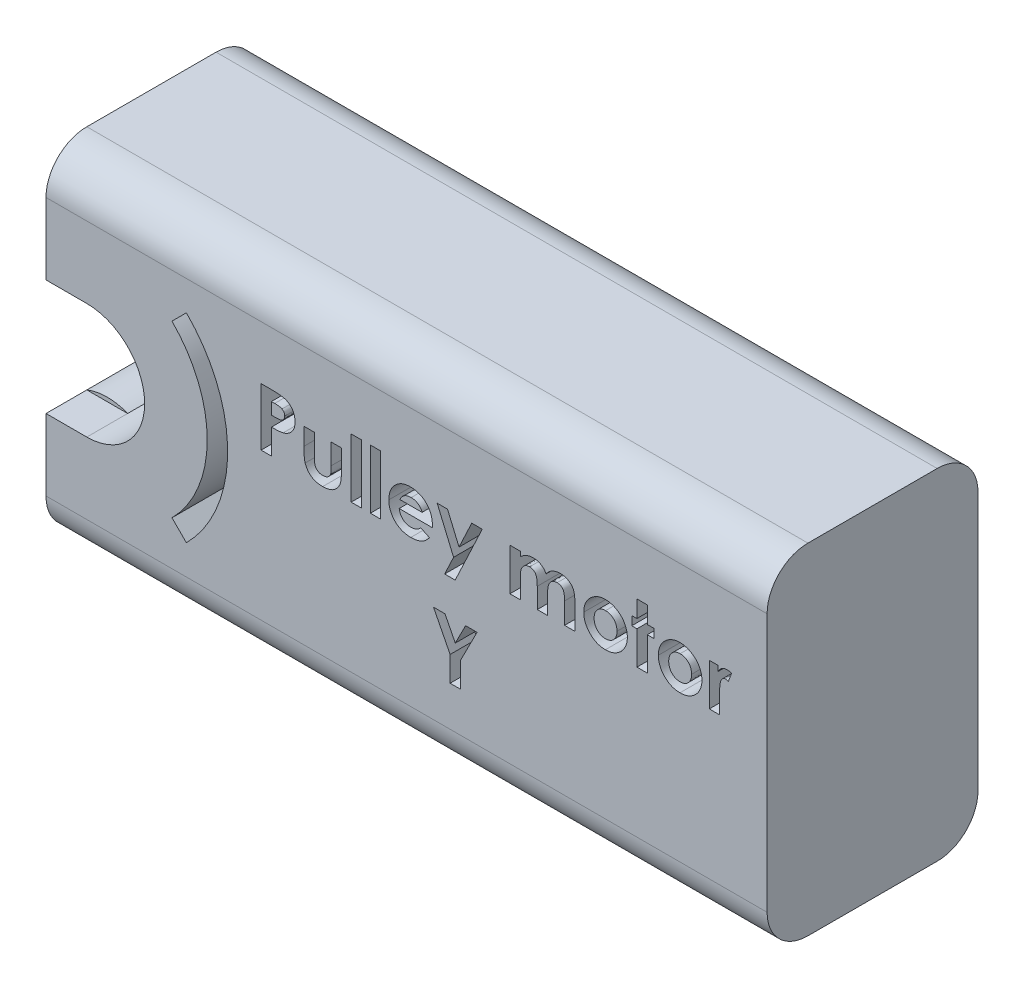
from build123d import *

# Parameters (mm, degrees)
SALIENTE_EXTRUIR1_DEPTH = 15.5
CORTAR_EXTRUIR1_DEPTH   = 5
CROQUIS4_W              = 0.75982906
CROQUIS4_H              = 4.341880342
CORTAR_EXTRUIR2_DEPTH   = 2
CROQUIS6_W              = 15.5
CROQUIS6_H              = 8.25
SALIENTE_EXTRUIR3_DEPTH = 3
REDONDEO1_R             = 3
SALIENTE_EXTRUIR4_START = -3
SALIENTE_EXTRUIR4_DEPTH = 9.5


with BuildPart() as part:
    # Croquis1 → Saliente-Extruir1 (new body)
    with BuildSketch(Plane.XY):
        with BuildLine():
            Line((0, 0), (0, 25))
            Line((0, 25), (-50, 25))
            Line((-50, 25), (-50, 16.75))
            ThreePointArc((-50, 16.75), (-45.75, 12.5), (-50, 8.25))
            Line((-50, 8.25), (-50, 0))
            Line((-50, 0), (0, 0))
        make_face()
    extrude(amount=SALIENTE_EXTRUIR1_DEPTH)

    # Croquis3 → Cortar-Extruir1 (cut)
    with BuildSketch(Plane.XY.offset(15.5)):
        with BuildLine():
            Line((-42.681444815, 19.818555185), (-43.742104986, 18.757895014))
            ThreePointArc((-43.742104986, 18.757895014), (-41.823666137, 15.886748376), (-41.15, 12.5))
            ThreePointArc((-41.15, 12.5), (-41.823666137, 9.113251624), (-43.742104986, 6.242104986))
            Line((-43.742104986, 6.242104986), (-42.681444815, 5.181444815))
            ThreePointArc((-42.681444815, 5.181444815), (-40.437846839, 8.539226475), (-39.65, 12.5))
            ThreePointArc((-39.65, 12.5), (-40.437846839, 16.460773525), (-42.681444815, 19.818555185))
        make_face()
    extrude(amount=-CORTAR_EXTRUIR1_DEPTH, mode=Mode.SUBTRACT)

    # Croquis4 → Cortar-Extruir2 (cut)
    # profile 1 of 12: a face of its own
    with BuildSketch(Plane.XY.offset(15.5)):
        with BuildLine():
            Line((-37.191847505, 18.055477721), (-36.343824001, 18.055477721))
            add(Edge.make_bspline(
                [(-36.343824001, 18.055477721), (-36.288415245, 18.055229699), (-36.181520141, 18.054751214), (-36.027368607, 18.048948944), (-35.885156268, 18.038550923), (-35.754915799, 18.025700613), (-35.636700751, 18.007684978), (-35.530363083, 17.987031464), (-35.435880728, 17.961869473), (-35.352188257, 17.932002537), (-35.277076967, 17.896790588), (-35.205997461, 17.859287348), (-35.140556144, 17.814528554), (-35.077449995, 17.767338118), (-35.0202869, 17.713207957), (-34.965500685, 17.655740511), (-34.915411695, 17.592656668), (-34.869787835, 17.524720042), (-34.828399965, 17.453185811), (-34.792240752, 17.377926092), (-34.762910424, 17.298821796), (-34.738305926, 17.216384637), (-34.718543353, 17.130618207), (-34.705388755, 17.040995036), (-34.696453491, 16.948140907), (-34.695665077, 16.884944328), (-34.695266309, 16.852980392)],
                knots=[0, 0, 0, 0, 1.698747864, 3.27724071, 4.728299578, 6.070144658, 7.288476769, 8.393259625, 9.389771311, 10.283485332, 11.113357557, 11.931608583, 12.74405601, 13.541433047, 14.344816069, 15.154114104, 15.974336324, 16.810834471, 17.661136416, 18.50621059, 19.367396281, 20.244825668, 21.142564693, 22.063065223, 23.020325768, 24, 24, 24, 24], degree=3))
            add(Edge.make_bspline(
                [(-34.695266309, 16.852980392), (-34.695843277, 16.81761945), (-34.69697709, 16.748130854), (-34.708092114, 16.646269098), (-34.727080085, 16.549153135), (-34.751896371, 16.455963971), (-34.786500917, 16.368234773), (-34.826034986, 16.283872295), (-34.87467443, 16.205241803), (-34.930252771, 16.131359723), (-34.99095066, 16.06162536), (-35.058209062, 15.998052162), (-35.130746004, 15.940206751), (-35.208141594, 15.887482904), (-35.290686399, 15.839986976), (-35.37832086, 15.797274219), (-35.471643393, 15.760710719), (-35.536630397, 15.741588305), (-35.569578542, 15.731893319)],
                knots=[0, 0, 0, 0, 1.102006807, 2.165578795, 3.188629044, 4.184801286, 5.166646146, 6.124351954, 7.085497154, 8.042432466, 9.003981491, 9.963833307, 10.922997304, 11.89326795, 12.880200226, 13.889073926, 14.929769137, 16, 16, 16, 16], degree=3))
            add(Edge.make_bspline(
                [(-35.569578542, 15.731893319), (-35.591280085, 15.72649394), (-35.638292616, 15.714797146), (-35.716085443, 15.702921964), (-35.805733508, 15.692003465), (-35.907526702, 15.682620337), (-36.021523711, 15.676241996), (-36.147614156, 15.671260795), (-36.28585518, 15.667638948), (-36.381982521, 15.667510429), (-36.432018445, 15.667443533)],
                knots=[0, 0, 0, 0, 0.618981996, 1.340914327, 2.176866532, 3.120127938, 4.170906482, 5.338178032, 6.614476169, 8, 8, 8, 8], degree=3))
            Line((-36.432018445, 15.667443533), (-36.432018445, 13.822144387))
            Line((-36.432018445, 13.822144387), (-37.191847505, 13.822144387))
            Line((-37.191847505, 13.822144387), (-37.191847505, 18.055477721))
        make_face()
        with BuildLine():
            Line((-36.432018445, 16.427272592), (-36.163194995, 16.427272592))
            add(Edge.make_bspline(
                [(-36.163194995, 16.427272592), (-36.114278324, 16.427582762), (-36.024270922, 16.428153479), (-35.901352597, 16.436406375), (-35.802573066, 16.449010215), (-35.724535402, 16.467087036), (-35.662917275, 16.494521006), (-35.609775498, 16.526256943), (-35.564194439, 16.566386165), (-35.524727951, 16.612240666), (-35.493175684, 16.664929787), (-35.471295829, 16.723595586), (-35.457083106, 16.787005433), (-35.455770429, 16.83113449), (-35.455095369, 16.853828415)],
                knots=[0, 0, 0, 0, 1.8619151, 3.425951444, 4.686033666, 5.651700536, 6.461346321, 7.243864085, 7.999046032, 8.762387399, 9.539336099, 10.322741239, 11.137448474, 12, 12, 12, 12], degree=3))
            add(Edge.make_bspline(
                [(-35.455095369, 16.853828415), (-35.455763485, 16.873655802), (-35.457059793, 16.9121257), (-35.466582819, 16.967647305), (-35.481759783, 17.019404894), (-35.503750621, 17.066857929), (-35.532179567, 17.109925778), (-35.566840205, 17.148591475), (-35.607287772, 17.183683081), (-35.638515658, 17.202257603), (-35.654380892, 17.211694334)],
                knots=[0, 0, 0, 0, 1.102301479, 2.1387299, 3.123554645, 4.094223062, 5.036071848, 5.982632524, 6.975082478, 8, 8, 8, 8], degree=3))
            add(Edge.make_bspline(
                [(-35.654380892, 17.211694334), (-35.667819661, 17.218490705), (-35.69627229, 17.232880015), (-35.744729875, 17.24960864), (-35.800649187, 17.263721078), (-35.864407747, 17.275434265), (-35.935751201, 17.284524915), (-36.014666822, 17.291476988), (-36.101270741, 17.294272688), (-36.161498585, 17.295177352), (-36.192875817, 17.295648661)],
                knots=[0, 0, 0, 0, 0.656809284, 1.390599849, 2.23162475, 3.173112763, 4.218524733, 5.370385145, 6.63003504, 8, 8, 8, 8], degree=3))
            Line((-36.192875817, 17.295648661), (-36.432018445, 17.295648661))
            Line((-36.432018445, 17.295648661), (-36.432018445, 16.427272592))
        make_face(mode=Mode.SUBTRACT)
    # profile 2 of 12: a face of its own
    with BuildSketch(Plane.XY.offset(15.5)):
        with BuildLine():
            Line((-34.043984257, 16.915734131), (-33.284155198, 16.915734131))
            Line((-33.284155198, 16.915734131), (-33.284155198, 15.430844975))
            add(Edge.make_bspline(
                [(-33.284155198, 15.430844975), (-33.284087724, 15.396072455), (-33.283958227, 15.329335498), (-33.280354732, 15.233488162), (-33.275298316, 15.145840162), (-33.268988251, 15.066288145), (-33.259570075, 14.995023461), (-33.248697188, 14.932182155), (-33.236370841, 14.877311448), (-33.216326645, 14.81615073), (-33.184967138, 14.749222087), (-33.137608732, 14.678169473), (-33.080243889, 14.616729738), (-33.013647647, 14.564357634), (-32.937139894, 14.523087267), (-32.851774708, 14.495118969), (-32.758626155, 14.476321365), (-32.693748328, 14.474416846), (-32.660009898, 14.473426439)],
                knots=[0, 0, 0, 0, 1.267339619, 2.432334223, 3.495366327, 4.467371443, 5.340232306, 6.114347373, 6.791623365, 7.387877112, 8.457231658, 9.474542289, 10.487879852, 11.508108106, 12.54995813, 13.638205937, 14.771795776, 16, 16, 16, 16], degree=3))
            add(Edge.make_bspline(
                [(-32.660009898, 14.473426439), (-32.626301409, 14.474556848), (-32.561255797, 14.476738145), (-32.467487491, 14.493748472), (-32.381921236, 14.522896235), (-32.303678212, 14.562431736), (-32.23506581, 14.615343269), (-32.175327798, 14.678391115), (-32.125029794, 14.752592313), (-32.100859283, 14.80794428), (-32.088442057, 14.836380498)],
                knots=[0, 0, 0, 0, 1.116871431, 2.155171802, 3.144773418, 4.104381479, 5.046960687, 6.001340237, 6.973219418, 8, 8, 8, 8], degree=3))
            add(Edge.make_bspline(
                [(-32.088442057, 14.836380498), (-32.083885352, 14.849012122), (-32.073826951, 14.876894973), (-32.064874775, 14.924996728), (-32.055239569, 14.981724961), (-32.047617778, 15.048235743), (-32.0433051, 15.124117169), (-32.038684507, 15.209464874), (-32.03632977, 15.304193857), (-32.036024404, 15.370634402), (-32.035864599, 15.40540427)],
                knots=[0, 0, 0, 0, 0.56094539, 1.238222264, 2.041156151, 2.969685991, 4.036367568, 5.220421584, 6.545382566, 8, 8, 8, 8], degree=3))
            Line((-32.035864599, 15.40540427), (-32.035864599, 16.915734131))
            Line((-32.035864599, 16.915734131), (-31.27603554, 16.915734131))
            Line((-31.27603554, 16.915734131), (-31.27603554, 15.615714099))
            add(Edge.make_bspline(
                [(-31.27603554, 15.615714099), (-31.276167103, 15.551256349), (-31.276419351, 15.427671333), (-31.283648605, 15.250392643), (-31.293625795, 15.08921093), (-31.306474497, 14.943682411), (-31.324987889, 14.813746689), (-31.347714063, 14.699708467), (-31.372856468, 14.600814166), (-31.395912991, 14.542218609), (-31.406631159, 14.51497959)],
                knots=[0, 0, 0, 0, 1.388070971, 2.661352173, 3.82033814, 4.865898334, 5.806910977, 6.645039373, 7.370126333, 8, 8, 8, 8], degree=3))
            add(Edge.make_bspline(
                [(-31.406631159, 14.51497959), (-31.420369091, 14.48566199), (-31.447486587, 14.427791566), (-31.494540484, 14.345512639), (-31.545267221, 14.267559875), (-31.602080395, 14.195768204), (-31.663820273, 14.12940798), (-31.728741663, 14.066970673), (-31.799768287, 14.010998825), (-31.875058162, 13.960052123), (-31.955661854, 13.914827164), (-32.041027286, 13.874750191), (-32.132076968, 13.842134407), (-32.228021391, 13.814487929), (-32.329302797, 13.793870529), (-32.435717164, 13.778254422), (-32.547381205, 13.770183958), (-32.623534013, 13.768654541), (-32.662553969, 13.767870883)],
                knots=[0, 0, 0, 0, 0.997311338, 1.968606903, 2.91805772, 3.860812155, 4.785445165, 5.709667791, 6.633356648, 7.568312411, 8.508286151, 9.478643871, 10.470653671, 11.485274776, 12.552984541, 13.653035246, 14.797438149, 16, 16, 16, 16], degree=3))
            add(Edge.make_bspline(
                [(-32.662553969, 13.767870883), (-32.704706486, 13.76837323), (-32.787184669, 13.769356152), (-32.907684141, 13.781393098), (-33.022521758, 13.796967342), (-33.130415365, 13.82344641), (-33.232871746, 13.854123736), (-33.328714645, 13.893276163), (-33.418335698, 13.939308324), (-33.501911249, 13.991947315), (-33.578793115, 14.051675516), (-33.650690851, 14.115911117), (-33.715283288, 14.187209848), (-33.774679108, 14.263369977), (-33.828215418, 14.345092443), (-33.875918792, 14.432086666), (-33.917829636, 14.524748339), (-33.94019115, 14.58969094), (-33.951549695, 14.622678575)],
                knots=[0, 0, 0, 0, 1.211240017, 2.369985978, 3.478996442, 4.539426614, 5.559871561, 6.551301256, 7.510778031, 8.453136967, 9.386094087, 10.30661716, 11.221130616, 12.147659962, 13.080758632, 14.026335491, 14.997475882, 16, 16, 16, 16], degree=3))
            add(Edge.make_bspline(
                [(-33.951549695, 14.622678575), (-33.959298865, 14.648298035), (-33.975992384, 14.703488325), (-33.994016269, 14.795208144), (-34.008432428, 14.900920371), (-34.022456011, 15.020728989), (-34.032239119, 15.154834857), (-34.038633475, 15.303024997), (-34.042953943, 15.465589194), (-34.043630701, 15.578680747), (-34.043984257, 15.63776271)],
                knots=[0, 0, 0, 0, 0.627914866, 1.352675004, 2.190563461, 3.132055958, 4.183353232, 5.345633452, 6.613289997, 8, 8, 8, 8], degree=3))
            Line((-34.043984257, 15.63776271), (-34.043984257, 16.915734131))
        make_face()
    # profile 3 of 12: a face of its own
    with BuildSketch(Plane.XY.offset(15.5)):
        with Locations((-30.190565454, 15.993084558)):
            Rectangle(CROQUIS4_W, CROQUIS4_H)
    # profile 4 of 12: a face of its own
    with BuildSketch(Plane.XY.offset(15.5)):
        with Locations((-28.779454343, 15.993084558)):
            Rectangle(CROQUIS4_W, CROQUIS4_H)
    # profile 5 of 12: a face of its own
    with BuildSketch(Plane.XY.offset(15.5)):
        with BuildLine():
            Line((-24.602938584, 15.178981994), (-27.042702206, 15.178981994))
            add(Edge.make_bspline(
                [(-27.042702206, 15.178981994), (-27.037727725, 15.150633325), (-27.027952477, 15.094925953), (-27.00672518, 15.014006163), (-26.979635964, 14.937748717), (-26.947171245, 14.86605168), (-26.909878378, 14.798536018), (-26.866379337, 14.735518404), (-26.81722587, 14.677054501), (-26.762702168, 14.623398398), (-26.703717042, 14.575321367), (-26.640556548, 14.533202849), (-26.573155509, 14.49866824), (-26.502286653, 14.469559149), (-26.427420425, 14.4465018), (-26.348446641, 14.430599584), (-26.26557465, 14.421206088), (-26.209119717, 14.419847426), (-26.180262302, 14.419152934)],
                knots=[0, 0, 0, 0, 1.091296461, 2.144483647, 3.168565212, 4.157007626, 5.126487748, 6.090021542, 7.05641414, 8.019231907, 8.98705074, 9.938580405, 10.892824166, 11.854447369, 12.841318655, 13.858982407, 14.905600794, 16, 16, 16, 16], degree=3))
            add(Edge.make_bspline(
                [(-26.180262302, 14.419152934), (-26.145429444, 14.420072555), (-26.076833286, 14.42188356), (-25.976339406, 14.437944483), (-25.879147184, 14.462203801), (-25.786176403, 14.498279443), (-25.696350142, 14.543187276), (-25.611147216, 14.599136911), (-25.52909283, 14.664493315), (-25.479029985, 14.714870006), (-25.453506159, 14.740553842)],
                knots=[0, 0, 0, 0, 1.021034703, 2.010718019, 2.977989445, 3.954245119, 4.929443971, 5.918328161, 6.938689359, 8, 8, 8, 8], degree=3))
            Line((-25.453506159, 14.740553842), (-24.817488531, 14.437809451))
            add(Edge.make_bspline(
                [(-24.817488531, 14.437809451), (-24.837513175, 14.410138467), (-24.87719127, 14.355309429), (-24.941964429, 14.278150812), (-25.009559345, 14.206158691), (-25.08002643, 14.139806572), (-25.153455054, 14.07928353), (-25.229640957, 14.023852285), (-25.309697563, 13.975001145), (-25.392024156, 13.93036672), (-25.47832258, 13.892101835), (-25.568354006, 13.859470892), (-25.661737104, 13.829972797), (-25.759651098, 13.807496864), (-25.86128066, 13.789705099), (-25.966868909, 13.777070589), (-26.076401927, 13.769266858), (-26.150850881, 13.768341735), (-26.188742537, 13.767870883)],
                knots=[0, 0, 0, 0, 1.028154879, 2.037251081, 3.030720504, 4.000128189, 4.949298328, 5.894184978, 6.834267904, 7.770992897, 8.712077017, 9.673380525, 10.653304757, 11.658697181, 12.695551717, 13.758623199, 14.859225354, 16, 16, 16, 16], degree=3))
            add(Edge.make_bspline(
                [(-26.188742537, 13.767870883), (-26.247038228, 13.769059357), (-26.36120698, 13.771386914), (-26.528199417, 13.792989977), (-26.686795915, 13.828810185), (-26.837444295, 13.877502256), (-26.979493355, 13.941791043), (-27.113013395, 14.020421564), (-27.239338471, 14.111886312), (-27.354608648, 14.21810489), (-27.459623179, 14.333717498), (-27.551861414, 14.457877544), (-27.629045055, 14.589717568), (-27.692429814, 14.728365027), (-27.74169465, 14.874174802), (-27.77721174, 15.027210524), (-27.798984141, 15.187399098), (-27.801335669, 15.296505398), (-27.802531266, 15.351978789)],
                knots=[0, 0, 0, 0, 1.103565453, 2.161269334, 3.182010356, 4.179077853, 5.15417608, 6.128274628, 7.109042802, 8.101804412, 9.090965879, 10.063106201, 11.02526161, 11.978650795, 12.945248442, 13.93468508, 14.949922959, 16, 16, 16, 16], degree=3))
            add(Edge.make_bspline(
                [(-27.802531266, 15.351978789), (-27.801323901, 15.40886183), (-27.798948466, 15.520776657), (-27.7773992, 15.684664059), (-27.741596458, 15.841034807), (-27.692187511, 15.99010424), (-27.629764307, 16.132338584), (-27.551598636, 16.266493458), (-27.459668952, 16.393035917), (-27.355032733, 16.511373982), (-27.239274237, 16.618187015), (-27.116269898, 16.713378772), (-26.984637637, 16.792698863), (-26.845866328, 16.856789448), (-26.700843602, 16.90886143), (-26.547893199, 16.943510985), (-26.388178838, 16.966776087), (-26.279001618, 16.968918658), (-26.223511501, 16.970007635)],
                knots=[0, 0, 0, 0, 1.079208495, 2.12329425, 3.130605359, 4.119693003, 5.099659317, 6.073216462, 7.060498243, 8.06384408, 9.066070512, 10.045757761, 11.010926815, 11.975797609, 12.942977511, 13.929384301, 14.947594487, 16, 16, 16, 16], degree=3))
            add(Edge.make_bspline(
                [(-26.223511501, 16.970007635), (-26.164936534, 16.968800723), (-26.049930623, 16.966431076), (-25.881775135, 16.945003424), (-25.722125575, 16.908964789), (-25.570301747, 16.86069375), (-25.428242503, 16.79478096), (-25.292826371, 16.718085412), (-25.167301398, 16.624643584), (-25.05032962, 16.518944805), (-24.944738685, 16.401675673), (-24.852440509, 16.274285479), (-24.77390612, 16.138017476), (-24.710253219, 15.992319069), (-24.661038968, 15.837627657), (-24.625489001, 15.67414414), (-24.603882671, 15.501246702), (-24.6015749, 15.382853918), (-24.600394514, 15.322297966)],
                knots=[0, 0, 0, 0, 1.080001299, 2.120471247, 3.119684163, 4.095710327, 5.052285597, 6.002875087, 6.961153713, 7.931888285, 8.906493152, 9.865905668, 10.82813294, 11.801621613, 12.7925306, 13.817193356, 14.883530496, 16, 16, 16, 16], degree=3))
            Line((-24.600394514, 15.322297966), (-24.602938584, 15.178981994))
        make_face()
        with BuildLine():
            add(Edge.make_bspline(
                [(-25.360223574, 15.775990541), (-25.374562013, 15.81468418), (-25.403070565, 15.891617214), (-25.467470197, 15.997766028), (-25.552926449, 16.089695213), (-25.652318201, 16.171080849), (-25.765879501, 16.237138515), (-25.890031834, 16.284966411), (-26.023205937, 16.313644617), (-26.114822544, 16.317008067), (-26.161605785, 16.318725584)],
                knots=[0, 0, 0, 0, 0.954238005, 1.897273737, 2.851915805, 3.847685534, 4.862635127, 5.880135777, 6.917509367, 8, 8, 8, 8], degree=3))
            add(Edge.make_bspline(
                [(-26.161605785, 16.318725584), (-26.212700701, 16.3170757), (-26.312580624, 16.31385052), (-26.456650611, 16.279549546), (-26.592548225, 16.228356366), (-26.672665756, 16.175575112), (-26.712821063, 16.149120883)],
                knots=[0, 0, 0, 0, 1.044195649, 2.041185066, 3.018232172, 4, 4, 4, 4], degree=3))
            add(Edge.make_bspline(
                [(-26.712821063, 16.149120883), (-26.737874975, 16.128972763), (-26.791288636, 16.086018002), (-26.86065711, 16.00032733), (-26.928985635, 15.896575164), (-26.967834169, 15.817768063), (-26.988428702, 15.775990541)],
                knots=[0, 0, 0, 0, 0.82159062, 1.751589201, 2.808063854, 4, 4, 4, 4], degree=3))
            Line((-26.988428702, 15.775990541), (-25.360223574, 15.775990541))
        make_face(mode=Mode.SUBTRACT)
    # profile 6 of 12: a face of its own
    with BuildSketch(Plane.XY.offset(15.5)):
        Polygon((-24.249312783, 16.915734131), (-23.4886357, 16.915734131), (-22.64400429, 14.925422966), (-21.709482388, 16.915734131), (-20.936932975, 16.915734131), (-22.925548093, 12.682400798), (-23.698097505, 12.682400798), (-23.044271384, 14.074007368), align=None)
    # profile 7 of 12: a face of its own
    with BuildSketch(Plane.XY.offset(15.5)):
        with BuildLine():
            Line((-18.901676565, 16.915734131), (-18.141847505, 16.915734131))
            Line((-18.141847505, 16.915734131), (-18.141847505, 16.545995883))
            add(Edge.make_bspline(
                [(-18.141847505, 16.545995883), (-18.108050695, 16.580106577), (-18.041507553, 16.64726773), (-17.931232549, 16.73360943), (-17.816204554, 16.807442251), (-17.695029611, 16.867214566), (-17.568004108, 16.912855045), (-17.435730081, 16.946299715), (-17.297528114, 16.966031023), (-17.203431253, 16.968667404), (-17.15559617, 16.970007635)],
                knots=[0, 0, 0, 0, 1.041528618, 2.050684245, 3.032913108, 4.004406485, 4.976926473, 5.95771665, 6.961784757, 8, 8, 8, 8], degree=3))
            add(Edge.make_bspline(
                [(-17.15559617, 16.970007635), (-17.107697927, 16.968501022), (-17.013411786, 16.965535303), (-16.875848961, 16.938396195), (-16.745530164, 16.894304314), (-16.623889207, 16.831456756), (-16.51004694, 16.753843288), (-16.409046651, 16.657454155), (-16.318134253, 16.546126398), (-16.269674446, 16.461961417), (-16.244818926, 16.418792357)],
                knots=[0, 0, 0, 0, 1.023965777, 2.015643508, 2.987309376, 3.958410333, 4.93654923, 5.924956801, 6.93568961, 8, 8, 8, 8], degree=3))
            add(Edge.make_bspline(
                [(-16.244818926, 16.418792357), (-16.212801805, 16.462078853), (-16.149961181, 16.547038098), (-16.038570452, 16.657962024), (-15.91812384, 16.753853339), (-15.78629098, 16.832029753), (-15.646572897, 16.894089794), (-15.49958098, 16.938232369), (-15.346647905, 16.965489946), (-15.242568555, 16.968489228), (-15.189877687, 16.970007635)],
                knots=[0, 0, 0, 0, 1.041189987, 2.043563759, 3.033412161, 4.015238574, 5.00275396, 5.986226558, 6.980513695, 8, 8, 8, 8], degree=3))
            add(Edge.make_bspline(
                [(-15.189877687, 16.970007635), (-15.135454277, 16.968431004), (-15.029469745, 16.965360661), (-14.875882939, 16.935153863), (-14.73203031, 16.888479827), (-14.60109096, 16.820557681), (-14.482691438, 16.740101209), (-14.381800762, 16.645038531), (-14.29807072, 16.538686788), (-14.243551725, 16.43938021), (-14.208306659, 16.351581823), (-14.187025376, 16.275180776), (-14.167120791, 16.189869344), (-14.152821339, 16.09450082), (-14.139473432, 15.989971597), (-14.131724446, 15.875586728), (-14.126457381, 15.751731548), (-14.125897952, 15.666036824), (-14.125608189, 15.621650263)],
                knots=[0, 0, 0, 0, 1.321991808, 2.574456155, 3.791773975, 4.987670122, 6.148905103, 7.262530793, 8.344737981, 9.427709016, 10.004683293, 10.642050061, 11.354108788, 12.133887687, 12.985666279, 13.916212488, 14.92067847, 16, 16, 16, 16], degree=3))
            Line((-14.125608189, 15.621650263), (-14.125608189, 13.822144387))
            Line((-14.125608189, 13.822144387), (-14.885437249, 13.822144387))
            Line((-14.885437249, 13.822144387), (-14.885437249, 15.375723447))
            add(Edge.make_bspline(
                [(-14.885437249, 15.375723447), (-14.886069663, 15.417278799), (-14.887283524, 15.497040542), (-14.892444115, 15.611443535), (-14.903995726, 15.715197176), (-14.917535694, 15.808876165), (-14.936911649, 15.891983805), (-14.960537108, 15.964720437), (-14.987942497, 16.027190762), (-15.021033678, 16.079388271), (-15.05809584, 16.123346818), (-15.099322148, 16.161027998), (-15.144282756, 16.193177501), (-15.193385297, 16.220580384), (-15.247916132, 16.239113496), (-15.306034387, 16.253655237), (-15.368194853, 16.263558267), (-15.411172585, 16.264148656), (-15.433260433, 16.26445208)],
                knots=[0, 0, 0, 0, 1.669139205, 3.203761885, 4.596586177, 5.860166715, 7.002923539, 8.018877315, 8.928339525, 9.734594377, 10.491888885, 11.231098709, 11.971440889, 12.708030942, 13.480072485, 14.275788656, 15.113863979, 16, 16, 16, 16], degree=3))
            add(Edge.make_bspline(
                [(-15.433260433, 16.26445208), (-15.467297492, 16.26327533), (-15.534088449, 16.260966194), (-15.631416486, 16.238899809), (-15.723002886, 16.202823631), (-15.808504528, 16.153745187), (-15.886081608, 16.092447137), (-15.953941915, 16.019741806), (-16.009985064, 15.935210185), (-16.048779499, 15.856781797), (-16.073021147, 15.785866776), (-16.090121427, 15.725133754), (-16.103450415, 15.656453691), (-16.11388311, 15.580522155), (-16.123892063, 15.496909898), (-16.1288024, 15.405722651), (-16.133827172, 15.307087095), (-16.13376176, 15.238917236), (-16.133727847, 15.203574676)],
                knots=[0, 0, 0, 0, 1.129913425, 2.217230253, 3.297175357, 4.391411011, 5.481605898, 6.571841268, 7.681894157, 8.841607612, 9.468549532, 10.170608623, 10.93710061, 11.791434153, 12.717934886, 13.734733707, 14.825576123, 16, 16, 16, 16], degree=3))
            Line((-16.133727847, 15.203574676), (-16.133727847, 13.822144387))
            Line((-16.133727847, 13.822144387), (-16.893556907, 13.822144387))
            Line((-16.893556907, 13.822144387), (-16.893556907, 15.305337496))
            add(Edge.make_bspline(
                [(-16.893556907, 15.305337496), (-16.893620702, 15.338414655), (-16.893743424, 15.402044395), (-16.897432197, 15.493926958), (-16.902316853, 15.578767903), (-16.909164571, 15.656803869), (-16.917062066, 15.727937797), (-16.928459971, 15.791780536), (-16.940434522, 15.848683878), (-16.960965051, 15.913324376), (-16.989895207, 15.984956866), (-17.033117282, 16.060919133), (-17.085378675, 16.12451963), (-17.145358481, 16.176253304), (-17.213138236, 16.215670212), (-17.287000866, 16.244991492), (-17.368356734, 16.26081822), (-17.424356675, 16.263215231), (-17.45325242, 16.26445208)],
                knots=[0, 0, 0, 0, 1.256487322, 2.417074606, 3.49288742, 4.484586665, 5.393016842, 6.210437544, 6.947749329, 7.599905853, 8.784490193, 9.876739139, 10.906602197, 11.896672079, 12.869113195, 13.872201355, 14.902064413, 16, 16, 16, 16], degree=3))
            add(Edge.make_bspline(
                [(-17.45325242, 16.26445208), (-17.485902125, 16.263343892), (-17.55056514, 16.261149117), (-17.6447567, 16.237575441), (-17.734812566, 16.202161194), (-17.818751602, 16.151713878), (-17.895159978, 16.088973298), (-17.962340859, 16.014199925), (-18.01808948, 15.927482451), (-18.057056116, 15.846890727), (-18.080944292, 15.774206474), (-18.098504373, 15.711896462), (-18.111337439, 15.641703909), (-18.122044649, 15.564416952), (-18.131994346, 15.479944362), (-18.136924999, 15.387914661), (-18.141944807, 15.288429858), (-18.141880721, 15.219695209), (-18.141847505, 15.184070135)],
                knots=[0, 0, 0, 0, 1.07893236, 2.136834559, 3.195274846, 4.273923004, 5.364443877, 6.458052972, 7.587287137, 8.767908, 9.410170275, 10.118584836, 10.909717261, 11.770069756, 12.702352573, 13.724628867, 14.820678298, 16, 16, 16, 16], degree=3))
            Line((-18.141847505, 15.184070135), (-18.141847505, 13.822144387))
            Line((-18.141847505, 13.822144387), (-18.901676565, 13.822144387))
            Line((-18.901676565, 13.822144387), (-18.901676565, 16.915734131))
        make_face()
    # profile 8 of 12: a face of its own
    with BuildSketch(Plane.XY.offset(15.5)):
        with BuildLine():
            add(Edge.make_bspline(
                [(-11.891914279, 16.970007635), (-11.855991028, 16.969368356), (-11.784846713, 16.968102295), (-11.678886144, 16.957563487), (-11.57477801, 16.940368987), (-11.471923911, 16.918105111), (-11.371278944, 16.886910091), (-11.272315238, 16.849496488), (-11.174147932, 16.806541296), (-11.079213519, 16.755409593), (-10.986826169, 16.699952599), (-10.899237463, 16.638778983), (-10.817174764, 16.572369245), (-10.73911471, 16.502263146), (-10.668695025, 16.425408495), (-10.601415513, 16.345508472), (-10.540911124, 16.259700538), (-10.484892774, 16.170075634), (-10.435020041, 16.077152043), (-10.391714744, 15.981576174), (-10.354129818, 15.884669432), (-10.324701574, 15.785251427), (-10.3003377, 15.684633116), (-10.284962364, 15.581581497), (-10.274031567, 15.47715517), (-10.272805878, 15.406846773), (-10.272189386, 15.37148333)],
                knots=[0, 0, 0, 0, 1.022364134, 2.024744242, 3.027414945, 4.024939316, 5.017584196, 6.023349371, 7.035562955, 8.064994934, 9.090267829, 10.101425541, 11.102933353, 12.093946398, 13.084502048, 14.067315274, 15.065326281, 16.070028806, 17.074376865, 18.064572984, 19.055292013, 20.030201733, 21.013838017, 21.999348303, 22.993720005, 24, 24, 24, 24], degree=3))
            add(Edge.make_bspline(
                [(-10.272189386, 15.37148333), (-10.272839991, 15.335843609), (-10.274133542, 15.264983766), (-10.284566902, 15.15957518), (-10.301827217, 15.056038958), (-10.324176542, 14.953765149), (-10.355254822, 14.854062446), (-10.391566474, 14.75546119), (-10.436140456, 14.659305354), (-10.485420277, 14.564545969), (-10.541798801, 14.473971513), (-10.602250817, 14.387303991), (-10.669248529, 14.306817098), (-10.739104484, 14.230014713), (-10.81513211, 14.159493947), (-10.896117863, 14.094109732), (-10.981360632, 14.033062717), (-11.071473402, 13.97778518), (-11.165301979, 13.929214779), (-11.261263961, 13.885424599), (-11.35992048, 13.848966147), (-11.461067363, 13.819235284), (-11.564765951, 13.79621542), (-11.670787304, 13.780577753), (-11.778903092, 13.769701936), (-11.851747253, 13.768485163), (-11.888522185, 13.767870883)],
                knots=[0, 0, 0, 0, 1.012026251, 2.012137606, 3.004615893, 3.992048833, 4.982446996, 5.968083444, 6.973977695, 7.990229942, 8.999482246, 10.001782172, 10.988562221, 11.971415814, 12.948383116, 13.930088534, 14.925840678, 15.924049238, 16.929462851, 17.924729459, 18.917889337, 19.913673841, 20.916777188, 21.931792057, 22.95587778, 24, 24, 24, 24], degree=3))
            add(Edge.make_bspline(
                [(-11.888522185, 13.767870883), (-11.942294634, 13.76944921), (-12.048280951, 13.772560118), (-12.204373738, 13.79386902), (-12.35432738, 13.830547226), (-12.498386223, 13.881675838), (-12.636737403, 13.947195248), (-12.768173504, 14.028285468), (-12.894001954, 14.123350063), (-13.012043311, 14.23158554), (-13.120185186, 14.350329659), (-13.214660124, 14.477088282), (-13.294876991, 14.609961511), (-13.360763618, 14.749100866), (-13.411614658, 14.894697145), (-13.448337785, 15.046315066), (-13.46967274, 15.204380804), (-13.472757336, 15.311775226), (-13.474326138, 15.366395189)],
                knots=[0, 0, 0, 0, 1.029999031, 2.030143771, 3.011211297, 3.982305373, 4.953580601, 5.938004764, 6.935448627, 7.970290061, 9.001484052, 10.007591832, 10.993831261, 11.969999897, 12.951306496, 13.942897864, 14.953773953, 16, 16, 16, 16], degree=3))
            add(Edge.make_bspline(
                [(-13.474326138, 15.366395189), (-13.472702627, 15.424717335), (-13.46951165, 15.539348347), (-13.444173886, 15.707285391), (-13.403712211, 15.868077152), (-13.345632024, 16.021273845), (-13.271439695, 16.167158019), (-13.180867674, 16.305421989), (-13.07346835, 16.436097073), (-12.991221974, 16.515133844), (-12.949399589, 16.555324142)],
                knots=[0, 0, 0, 0, 1.043912699, 2.05178951, 3.033892, 4.007821512, 4.978932272, 5.95884105, 6.962068106, 8, 8, 8, 8], degree=3))
            add(Edge.make_bspline(
                [(-12.949399589, 16.555324142), (-12.911023369, 16.588637377), (-12.835315033, 16.654357496), (-12.712313904, 16.737712691), (-12.586374627, 16.80970615), (-12.455987766, 16.868898163), (-12.320789837, 16.913527986), (-12.181473651, 16.946014504), (-12.038068178, 16.965968675), (-11.940879824, 16.968654473), (-11.891914279, 16.970007635)],
                knots=[0, 0, 0, 0, 1.048115528, 2.067714963, 3.060638214, 4.039924844, 5.017819947, 5.994373833, 6.98952318, 8, 8, 8, 8], degree=3))
        make_face()
        with BuildLine():
            add(Edge.make_bspline(
                [(-11.874953809, 16.26445208), (-11.904372305, 16.263474306), (-11.962282931, 16.261549549), (-12.047528894, 16.25121989), (-12.128155424, 16.230048367), (-12.205763913, 16.203123984), (-12.278981461, 16.167116415), (-12.349813234, 16.124979262), (-12.414576136, 16.072249799), (-12.476404251, 16.014409437), (-12.532530399, 15.950179267), (-12.580355206, 15.880200544), (-12.623087731, 15.807150509), (-12.655489637, 15.728354708), (-12.682305312, 15.645966859), (-12.70045384, 15.558655825), (-12.713083948, 15.467396918), (-12.714021554, 15.404883941), (-12.714497078, 15.373179377)],
                knots=[0, 0, 0, 0, 1.030650113, 2.02884584, 2.99876339, 3.944280128, 4.900564847, 5.851248946, 6.823638398, 7.81794922, 8.81432732, 9.802856497, 10.78262424, 11.771747962, 12.779760563, 13.812642396, 14.89064281, 16, 16, 16, 16], degree=3))
            add(Edge.make_bspline(
                [(-12.714497078, 15.373179377), (-12.71394065, 15.34035675), (-12.71285322, 15.276211228), (-12.701592647, 15.182550141), (-12.683023593, 15.09366639), (-12.656642785, 15.009697282), (-12.623464465, 14.930040096), (-12.582758514, 14.855141764), (-12.534095326, 14.785452619), (-12.478923082, 14.721058479), (-12.418511831, 14.662607206), (-12.352317905, 14.61244651), (-12.283113257, 14.568863523), (-12.209303035, 14.533859658), (-12.131935557, 14.506833834), (-12.05078115, 14.486935629), (-11.965413348, 14.47621544), (-11.907205998, 14.474368889), (-11.877497879, 14.473426439)],
                knots=[0, 0, 0, 0, 1.141730614, 2.231293227, 3.276944405, 4.297399982, 5.28939179, 6.275415646, 7.257752684, 8.24146775, 9.222424823, 10.176631434, 11.126518621, 12.063689483, 13.012557477, 13.974037417, 14.965980454, 16, 16, 16, 16], degree=3))
            add(Edge.make_bspline(
                [(-11.877497879, 14.473426439), (-11.847774902, 14.47426235), (-11.789500611, 14.475901221), (-11.704032561, 14.488173779), (-11.62246372, 14.507488366), (-11.544435463, 14.534746792), (-11.470578655, 14.570499896), (-11.400610567, 14.61429139), (-11.33391568, 14.665149776), (-11.272693705, 14.724703913), (-11.216021693, 14.789298875), (-11.166323728, 14.859355904), (-11.124794234, 14.934254256), (-11.090732613, 15.013522669), (-11.06430009, 15.097052191), (-11.046038449, 15.185153289), (-11.033401589, 15.277552933), (-11.032485187, 15.340910232), (-11.032018445, 15.373179377)],
                knots=[0, 0, 0, 0, 1.031504075, 2.022346795, 2.991027682, 3.937587355, 4.885570121, 5.833146507, 6.798790848, 7.791235734, 8.792807298, 9.778388351, 10.766749885, 11.760164525, 12.768777521, 13.802286646, 14.880660483, 16, 16, 16, 16], degree=3))
            add(Edge.make_bspline(
                [(-11.032018445, 15.373179377), (-11.032581951, 15.405437243), (-11.033687733, 15.46873764), (-11.044949108, 15.561262253), (-11.063335931, 15.649078584), (-11.090056993, 15.731811665), (-11.123038106, 15.810405349), (-11.163772193, 15.884457345), (-11.212675372, 15.953602928), (-11.268115824, 16.017499236), (-11.329432677, 16.075130305), (-11.394477316, 16.126523228), (-11.464737113, 16.169029124), (-11.538893952, 16.204069156), (-11.617145127, 16.231027458), (-11.69940279, 16.251038432), (-11.785919035, 16.261606076), (-11.844965377, 16.263493497), (-11.874953809, 16.26445208)],
                knots=[0, 0, 0, 0, 1.123894411, 2.205445421, 3.243160173, 4.246488011, 5.231014757, 6.210004299, 7.185865357, 8.177612767, 9.153374344, 10.115157457, 11.061423229, 12.009021698, 12.96873347, 13.94135618, 14.954456845, 16, 16, 16, 16], degree=3))
        make_face(mode=Mode.SUBTRACT)
    # profile 9 of 12: a face of its own
    with BuildSketch(Plane.XY.offset(15.5)):
        Polygon((-9.56663383, 18.164024729), (-8.80680477, 18.164024729), (-8.80680477, 16.915734131), (-8.318343232, 16.915734131), (-8.318343232, 16.26445208), (-8.80680477, 16.26445208), (-8.80680477, 13.822144387), (-9.56663383, 13.822144387), (-9.56663383, 16.26445208), (-9.94654836, 16.26445208), (-9.94654836, 16.915734131), (-9.56663383, 16.915734131), align=None)
    # profile 10 of 12: a face of its own
    with BuildSketch(Plane.XY.offset(15.5)):
        with BuildLine():
            add(Edge.make_bspline(
                [(-6.410290347, 16.970007635), (-6.374367096, 16.969368356), (-6.303222781, 16.968102295), (-6.197262212, 16.957563487), (-6.093154078, 16.940368987), (-5.990299979, 16.918105111), (-5.889655012, 16.886910091), (-5.790691307, 16.849496488), (-5.692524001, 16.806541296), (-5.597589588, 16.755409593), (-5.505202237, 16.699952599), (-5.417613531, 16.638778983), (-5.335550832, 16.572369245), (-5.257490778, 16.502263146), (-5.187071093, 16.425408495), (-5.119791582, 16.345508472), (-5.059287192, 16.259700538), (-5.003268843, 16.170075634), (-4.953396109, 16.077152043), (-4.910090812, 15.981576174), (-4.872505886, 15.884669432), (-4.843077642, 15.785251427), (-4.818713769, 15.684633116), (-4.803338433, 15.581581497), (-4.792407635, 15.47715517), (-4.791181946, 15.406846773), (-4.790565454, 15.37148333)],
                knots=[0, 0, 0, 0, 1.022364134, 2.024744242, 3.027414945, 4.024939316, 5.017584196, 6.023349371, 7.035562955, 8.064994934, 9.090267829, 10.101425541, 11.102933353, 12.093946398, 13.084502048, 14.067315274, 15.065326281, 16.070028806, 17.074376865, 18.064572984, 19.055292013, 20.030201733, 21.013838017, 21.999348303, 22.993720005, 24, 24, 24, 24], degree=3))
            add(Edge.make_bspline(
                [(-4.790565454, 15.37148333), (-4.791216059, 15.335843609), (-4.79250961, 15.264983766), (-4.80294297, 15.15957518), (-4.820203285, 15.056038958), (-4.842552611, 14.953765149), (-4.87363089, 14.854062446), (-4.909942542, 14.75546119), (-4.954516524, 14.659305354), (-5.003796345, 14.564545969), (-5.060174869, 14.473971513), (-5.120626885, 14.387303991), (-5.187624597, 14.306817098), (-5.257480553, 14.230014713), (-5.333508179, 14.159493947), (-5.414493932, 14.094109732), (-5.499736701, 14.033062717), (-5.58984947, 13.97778518), (-5.683678047, 13.929214779), (-5.779640029, 13.885424599), (-5.878296549, 13.848966147), (-5.979443432, 13.819235284), (-6.08314202, 13.79621542), (-6.189163373, 13.780577753), (-6.297279161, 13.769701936), (-6.370123321, 13.768485163), (-6.406898253, 13.767870883)],
                knots=[0, 0, 0, 0, 1.012026251, 2.012137606, 3.004615893, 3.992048833, 4.982446996, 5.968083444, 6.973977695, 7.990229942, 8.999482246, 10.001782172, 10.988562221, 11.971415814, 12.948383116, 13.930088534, 14.925840678, 15.924049238, 16.929462851, 17.924729459, 18.917889337, 19.913673841, 20.916777188, 21.931792057, 22.95587778, 24, 24, 24, 24], degree=3))
            add(Edge.make_bspline(
                [(-6.406898253, 13.767870883), (-6.460670703, 13.76944921), (-6.56665702, 13.772560118), (-6.722749807, 13.79386902), (-6.872703448, 13.830547226), (-7.016762291, 13.881675838), (-7.155113472, 13.947195248), (-7.286549572, 14.028285468), (-7.412378023, 14.123350063), (-7.53041938, 14.23158554), (-7.638561254, 14.350329659), (-7.733036192, 14.477088282), (-7.81325306, 14.609961511), (-7.879139686, 14.749100866), (-7.929990726, 14.894697145), (-7.966713854, 15.046315066), (-7.988048808, 15.204380804), (-7.991133405, 15.311775226), (-7.992702206, 15.366395189)],
                knots=[0, 0, 0, 0, 1.029999031, 2.030143771, 3.011211297, 3.982305373, 4.953580601, 5.938004764, 6.935448627, 7.970290061, 9.001484052, 10.007591832, 10.993831261, 11.969999897, 12.951306496, 13.942897864, 14.953773953, 16, 16, 16, 16], degree=3))
            add(Edge.make_bspline(
                [(-7.992702206, 15.366395189), (-7.991078696, 15.424717335), (-7.987887718, 15.539348347), (-7.962549955, 15.707285391), (-7.922088279, 15.868077152), (-7.864008093, 16.021273845), (-7.789815763, 16.167158019), (-7.699243742, 16.305421989), (-7.591844419, 16.436097073), (-7.509598043, 16.515133844), (-7.467775657, 16.555324142)],
                knots=[0, 0, 0, 0, 1.043912699, 2.05178951, 3.033892, 4.007821512, 4.978932272, 5.95884105, 6.962068106, 8, 8, 8, 8], degree=3))
            add(Edge.make_bspline(
                [(-7.467775657, 16.555324142), (-7.429399438, 16.588637377), (-7.353691101, 16.654357496), (-7.230689972, 16.737712691), (-7.104750695, 16.80970615), (-6.974363835, 16.868898163), (-6.839165905, 16.913527986), (-6.699849719, 16.946014504), (-6.556444246, 16.965968675), (-6.459255892, 16.968654473), (-6.410290347, 16.970007635)],
                knots=[0, 0, 0, 0, 1.048115528, 2.067714963, 3.060638214, 4.039924844, 5.017819947, 5.994373833, 6.98952318, 8, 8, 8, 8], degree=3))
        make_face()
        with BuildLine():
            add(Edge.make_bspline(
                [(-6.393329877, 16.26445208), (-6.422748373, 16.263474306), (-6.480658999, 16.261549549), (-6.565904963, 16.25121989), (-6.646531492, 16.230048367), (-6.724139982, 16.203123984), (-6.797357529, 16.167116415), (-6.868189302, 16.124979262), (-6.932952204, 16.072249799), (-6.99478032, 16.014409437), (-7.050906467, 15.950179267), (-7.098731274, 15.880200544), (-7.141463799, 15.807150509), (-7.173865706, 15.728354708), (-7.200681381, 15.645966859), (-7.218829908, 15.558655825), (-7.231460016, 15.467396918), (-7.232397623, 15.404883941), (-7.232873146, 15.373179377)],
                knots=[0, 0, 0, 0, 1.030650113, 2.02884584, 2.99876339, 3.944280128, 4.900564847, 5.851248946, 6.823638398, 7.81794922, 8.81432732, 9.802856497, 10.78262424, 11.771747962, 12.779760563, 13.812642396, 14.89064281, 16, 16, 16, 16], degree=3))
            add(Edge.make_bspline(
                [(-7.232873146, 15.373179377), (-7.232316719, 15.34035675), (-7.231229288, 15.276211228), (-7.219968716, 15.182550141), (-7.201399661, 15.09366639), (-7.175018853, 15.009697282), (-7.141840533, 14.930040096), (-7.101134582, 14.855141764), (-7.052471394, 14.785452619), (-6.99729915, 14.721058479), (-6.936887899, 14.662607206), (-6.870693974, 14.61244651), (-6.801489325, 14.568863523), (-6.727679104, 14.533859658), (-6.650311625, 14.506833834), (-6.569157218, 14.486935629), (-6.483789416, 14.47621544), (-6.425582067, 14.474368889), (-6.395873948, 14.473426439)],
                knots=[0, 0, 0, 0, 1.141730614, 2.231293227, 3.276944405, 4.297399982, 5.28939179, 6.275415646, 7.257752684, 8.24146775, 9.222424823, 10.176631434, 11.126518621, 12.063689483, 13.012557477, 13.974037417, 14.965980454, 16, 16, 16, 16], degree=3))
            add(Edge.make_bspline(
                [(-6.395873948, 14.473426439), (-6.36615097, 14.47426235), (-6.30787668, 14.475901221), (-6.222408629, 14.488173779), (-6.140839788, 14.507488366), (-6.062811531, 14.534746792), (-5.988954724, 14.570499896), (-5.918986636, 14.61429139), (-5.852291749, 14.665149776), (-5.791069773, 14.724703913), (-5.734397761, 14.789298875), (-5.684699796, 14.859355904), (-5.643170303, 14.934254256), (-5.609108681, 15.013522669), (-5.582676158, 15.097052191), (-5.564414518, 15.185153289), (-5.551777657, 15.277552933), (-5.550861256, 15.340910232), (-5.550394514, 15.373179377)],
                knots=[0, 0, 0, 0, 1.031504075, 2.022346795, 2.991027682, 3.937587355, 4.885570121, 5.833146507, 6.798790848, 7.791235734, 8.792807298, 9.778388351, 10.766749885, 11.760164525, 12.768777521, 13.802286646, 14.880660483, 16, 16, 16, 16], degree=3))
            add(Edge.make_bspline(
                [(-5.550394514, 15.373179377), (-5.55095802, 15.405437243), (-5.552063801, 15.46873764), (-5.563325176, 15.561262253), (-5.581712, 15.649078584), (-5.608433061, 15.731811665), (-5.641414174, 15.810405349), (-5.682148261, 15.884457345), (-5.73105144, 15.953602928), (-5.786491892, 16.017499236), (-5.847808745, 16.075130305), (-5.912853385, 16.126523228), (-5.983113182, 16.169029124), (-6.05727002, 16.204069156), (-6.135521195, 16.231027458), (-6.217778858, 16.251038432), (-6.304295103, 16.261606076), (-6.363341446, 16.263493497), (-6.393329877, 16.26445208)],
                knots=[0, 0, 0, 0, 1.123894411, 2.205445421, 3.243160173, 4.246488011, 5.231014757, 6.210004299, 7.185865357, 8.177612767, 9.153374344, 10.115157457, 11.061423229, 12.009021698, 12.96873347, 13.94135618, 14.954456845, 16, 16, 16, 16], degree=3))
        make_face(mode=Mode.SUBTRACT)
    # profile 11 of 12: a face of its own
    with BuildSketch(Plane.XY.offset(15.5)):
        with BuildLine():
            Line((-4.247830411, 16.915734131), (-3.59654836, 16.915734131))
            Line((-3.59654836, 16.915734131), (-3.59654836, 16.534971577))
            add(Edge.make_bspline(
                [(-3.59654836, 16.534971577), (-3.578124841, 16.56881005), (-3.542115309, 16.634948749), (-3.475962778, 16.723726855), (-3.399964072, 16.798493299), (-3.316850058, 16.860811889), (-3.226368835, 16.909383111), (-3.130943328, 16.94399623), (-3.031389901, 16.966489961), (-2.963477927, 16.968826634), (-2.929153862, 16.970007635)],
                knots=[0, 0, 0, 0, 1.09866127, 2.147379032, 3.14564304, 4.131443017, 5.102343063, 6.064490016, 7.021754664, 8, 8, 8, 8], degree=3))
            add(Edge.make_bspline(
                [(-2.929153862, 16.970007635), (-2.904230308, 16.968840559), (-2.853477052, 16.966463976), (-2.776121947, 16.95264886), (-2.697650744, 16.927668504), (-2.646009931, 16.905177013), (-2.619625283, 16.89368552)],
                knots=[0, 0, 0, 0, 0.931404136, 1.896671404, 2.925354185, 4, 4, 4, 4], degree=3))
            Line((-2.619625283, 16.89368552), (-2.855375817, 16.25003568))
            add(Edge.make_bspline(
                [(-2.855375817, 16.25003568), (-2.876448549, 16.260217005), (-2.916057171, 16.279353976), (-2.973562014, 16.301937574), (-3.025750043, 16.315716982), (-3.058836296, 16.31777299), (-3.074165881, 16.318725584)],
                knots=[0, 0, 0, 0, 1.214386998, 2.282580073, 3.20428172, 4, 4, 4, 4], degree=3))
            add(Edge.make_bspline(
                [(-3.074165881, 16.318725584), (-3.088639991, 16.318094345), (-3.11711306, 16.316852589), (-3.159138512, 16.306211164), (-3.198717736, 16.287860357), (-3.237758054, 16.264351151), (-3.273179617, 16.231671597), (-3.3085793, 16.193839211), (-3.339775397, 16.147130098), (-3.372696326, 16.095140483), (-3.40072732, 16.031505242), (-3.424763034, 15.955537877), (-3.446179049, 15.866359394), (-3.46091619, 15.763496299), (-3.47516023, 15.64794397), (-3.483638632, 15.518854268), (-3.489957692, 15.376635386), (-3.49034406, 15.277361474), (-3.490545422, 15.225623287)],
                knots=[0, 0, 0, 0, 0.544232178, 1.070598461, 1.618251235, 2.182094276, 2.777567932, 3.425210017, 4.127676488, 4.886675562, 5.738955394, 6.734782583, 7.883056018, 9.186093582, 10.642914445, 12.264202625, 14.053029461, 16, 16, 16, 16], degree=3))
            Line((-3.490545422, 15.225623287), (-3.488001351, 15.074675103))
            Line((-3.488001351, 15.074675103), (-3.488001351, 13.822144387))
            Line((-3.488001351, 13.822144387), (-4.247830411, 13.822144387))
            Line((-4.247830411, 13.822144387), (-4.247830411, 16.915734131))
        make_face()
    # profile 12 of 12: a face of its own
    with BuildSketch(Plane.XY.offset(15.5)):
        Polygon((-24.518984257, 10.162742678), (-23.673504824, 10.162742678), (-22.917915881, 8.677853522), (-22.162326939, 10.162742678), (-21.316847505, 10.162742678), (-22.538001351, 7.762836161), (-22.538001351, 5.929409345), (-23.297830411, 5.929409345), (-23.297830411, 7.762836161), align=None)
    extrude(amount=-CORTAR_EXTRUIR2_DEPTH, mode=Mode.SUBTRACT)

    # Croquis6 → Saliente-Extruir3 (add)
    with BuildSketch(Plane.ZY.offset(50)):
        with Locations((7.75, 20.875)):
            Rectangle(CROQUIS6_W, CROQUIS6_H)
        with Locations((7.75, 4.125)):
            Rectangle(CROQUIS6_W, CROQUIS6_H)
    extrude(amount=SALIENTE_EXTRUIR3_DEPTH)

    # Redondeo1
    redondeo1_edges = [part.edges().sort_by_distance(p)[0] for p in [
        (-26.5, 25, 15.5),
        (-26.5, 0, 15.5),
        (-26.5, 25, 0),
        (-26.5, 0, 0),
    ]]
    fillet(redondeo1_edges, radius=REDONDEO1_R)

    # Croquis7 → Saliente-Extruir4 (add)
    with BuildSketch(Plane.XY.offset(15.5).offset(SALIENTE_EXTRUIR4_START)):
        with BuildLine():
            Line((-53, 16.75), (-50, 16.75))
            ThreePointArc((-50, 16.75), (-51.5, 16.458099244), (-53, 16.75))
        make_face()
        with BuildLine():
            Line((-53, 8.25), (-50, 8.25))
            ThreePointArc((-50, 8.25), (-51.5, 8.541900756), (-53, 8.25))
        make_face()
    extrude(amount=-SALIENTE_EXTRUIR4_DEPTH)


solid = part.part
